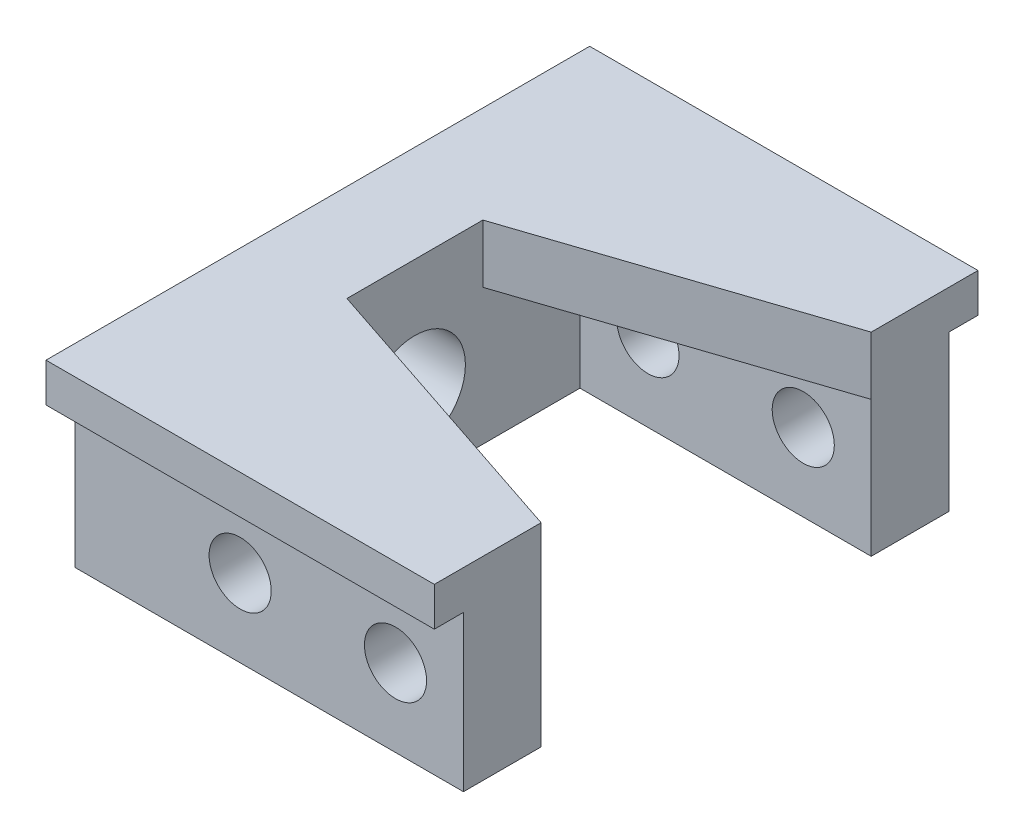
from build123d import *

# Parameters (mm, degrees)
SKETCH_1_W          = 25
SKETCH_1_H          = 11
SKETCH_1_R          = 2.6
EXTRUDE_1_DEPTH     = 5
SKETCH_2_W          = 4
SKETCH_2_H          = 11
EXTRUDE_2_DEPTH     = 15
SKETCH_4_R          = 1.6
CUT_EXTRUDE_1_DEPTH = 33.484611742
EXTRUDE_4_DEPTH     = 2
EXTRUDE_3_DEPTH     = 3
SKETCH_8_W          = 20
SKETCH_8_H          = 25
CUT_EXTRUDE_2_DEPTH = 3


with BuildPart() as part:
    # 草图1 → 凸台-拉伸1 (new body)
    with BuildSketch(Plane(origin=(0, 0, 0), x_dir=(0, 0, -1), z_dir=(1, 0, 0))):
        Rectangle(SKETCH_1_W, SKETCH_1_H)
        with Locations((0, 1.5)):
            Circle(SKETCH_1_R, mode=Mode.SUBTRACT)
    extrude(amount=EXTRUDE_1_DEPTH)

    # 草图2 → 凸台-拉伸2 (add)
    with BuildSketch(Plane(origin=(5, 0, 0), x_dir=(0, 0, -1), z_dir=(1, 0, 0))):
        with Locations((-10.5, 0)):
            Rectangle(SKETCH_2_W, SKETCH_2_H)
        with Locations((10.5, 0)):
            Rectangle(SKETCH_2_W, SKETCH_2_H)
    extrude(amount=EXTRUDE_2_DEPTH)

    # 草图4 → 切除-拉伸1 (cut, through all)
    with BuildSketch(Plane.XY.offset(12.5)):
        with Locations((16.5, 1.5)):
            Circle(SKETCH_4_R)
        with Locations((8.5, 1.5)):
            Circle(SKETCH_4_R)
    extrude(amount=-CUT_EXTRUDE_1_DEPTH, mode=Mode.SUBTRACT)

    # 草图7 → 凸台-拉伸4 (add)
    with BuildSketch(Plane(origin=(0, 5.5, 0), x_dir=(1, 0, 0), z_dir=(0, 1, 0))):
        Polygon((20, 8.5), (5, 8.5), (5, -8.5), (20, -8.5), (20, -14), (0, -14), (0, -8.5), (0, 8.5), (0, 14), (20, 14), align=None)
    extrude(amount=EXTRUDE_4_DEPTH)

    # 草图6 → 凸台-拉伸3 (add)
    with BuildSketch(Plane.XZ.offset(-7.5)):
        Polygon((20, 8.5), (5, 8.5), (5, 3.5), align=None)
        Polygon((5, -8.5), (5, -3.5), (20, -8.5), align=None)
    extrude(amount=EXTRUDE_3_DEPTH)

    # 草图8 → 切除-拉伸2 (cut)
    with BuildSketch(Plane.XZ.offset(5.5)):
        with Locations((10, 0)):
            Rectangle(SKETCH_8_W, SKETCH_8_H)
    extrude(amount=-CUT_EXTRUDE_2_DEPTH, mode=Mode.SUBTRACT)


solid = part.part
